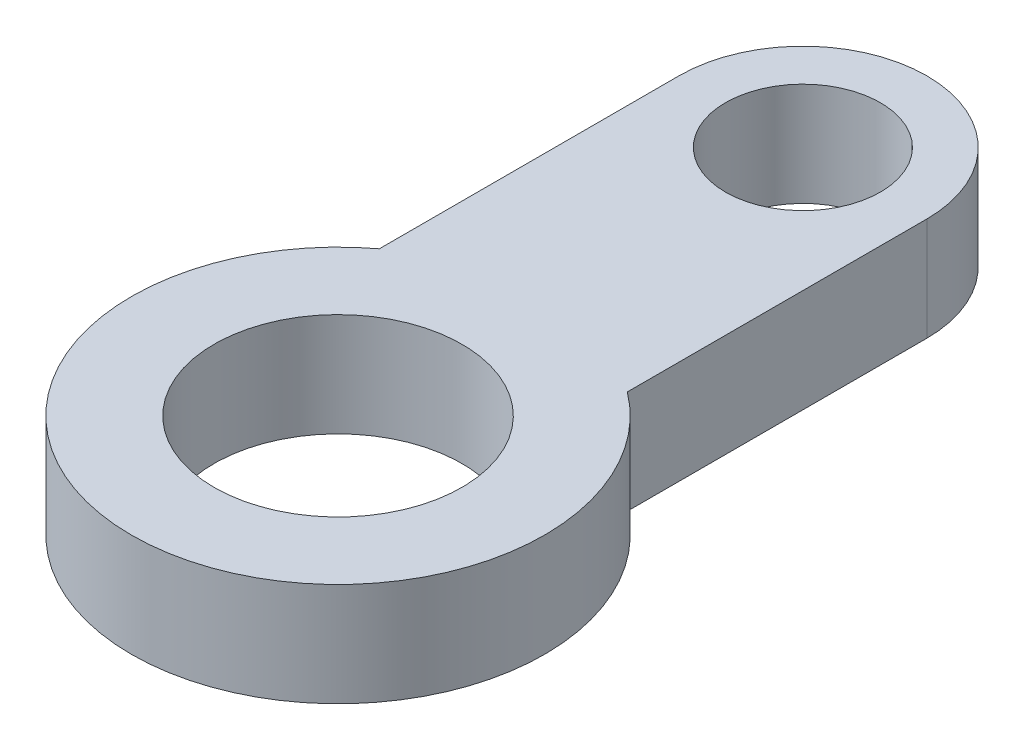
from build123d import *

# Parameters (mm, degrees)
SKETCH1_R           = 12
SKETCH1_R_2         = 7.5
BOSS_EXTRUDE1_DEPTH = 10


with BuildPart() as part:
    # Sketch1 → Boss-Extrude1 (new body)
    with BuildSketch(Plane(origin=(0, 0, 0), x_dir=(1, 0, 0), z_dir=(0, 1, 0))):
        with BuildLine():
            Line((-12, 16), (-12, 45))
            ThreePointArc((-12, 45), (0, 57), (12, 45))
            Line((12, 45), (12, 16))
            ThreePointArc((12, 16), (0, -20), (-12, 16))
        make_face()
        with Locations(Location((0, 0, 0), (0, 0, 270))):
            Circle(SKETCH1_R, mode=Mode.SUBTRACT)
        with Locations(Location((0, 45, 0), (0, 0, 270))):
            Circle(SKETCH1_R_2, mode=Mode.SUBTRACT)
    extrude(amount=BOSS_EXTRUDE1_DEPTH)


solid = part.part
